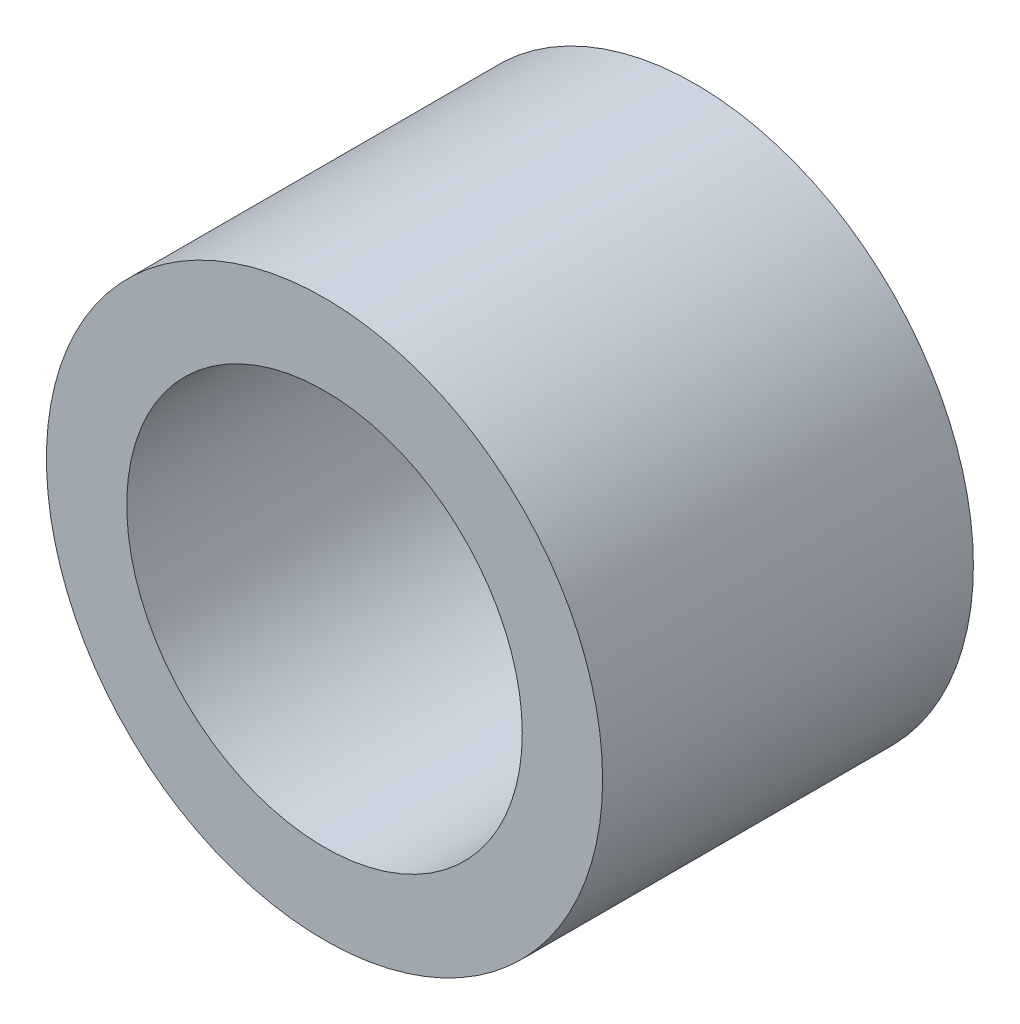
from build123d import *

# Parameters (mm, degrees)
SKETCH1_R      = 2.25
SKETCH1_R_2    = 1.6
EXTRUDE1_DEPTH = 1.5


with BuildPart() as part:
    # Sketch1 → Extrude1 (new, symmetric)
    with BuildSketch(Plane.XY):
        Circle(SKETCH1_R)
        Circle(SKETCH1_R_2, mode=Mode.SUBTRACT)
    extrude(amount=EXTRUDE1_DEPTH, both=True)


solid = part.part
